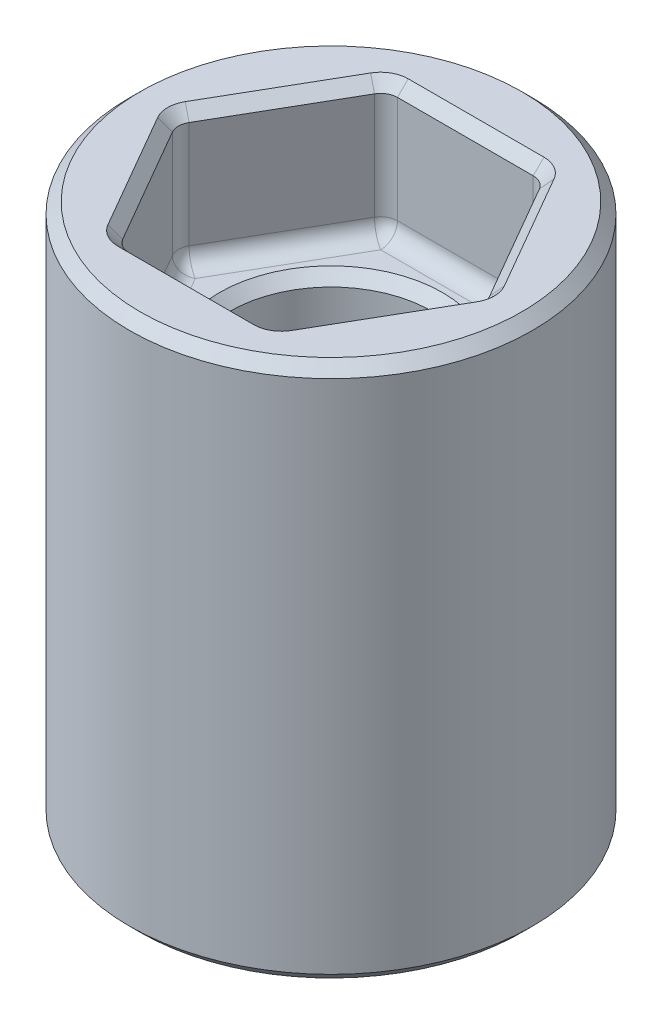
from build123d import *

# Parameters (mm, degrees)
SKETCH4_R           = 4.7625
SKETCH4_R_2         = 1.5875
BOSS_EXTRUDE1_DEPTH = 12.7
CUT_EXTRUDE3_DEPTH  = 3.175
CUT_EXTRUDE2_DEPTH  = 3.175
SKETCH8_R           = 2.38125
CUT_EXTRUDE4_DEPTH  = 3.175
FILLET1_R           = 0.396875
CHAMFER1_SIZE       = 0.254


with BuildPart() as part:
    # Sketch4 → Boss-Extrude1 (new body)
    with BuildSketch(Plane(origin=(0, 0, 0), x_dir=(1, 0, 0), z_dir=(0, 1, 0))):
        with Locations(Location((0, 0, 0), (0, 0, 270))):
            Circle(SKETCH4_R)
        with Locations(Location((0, 0, 0), (0, 0, 270))):
            Circle(SKETCH4_R_2, mode=Mode.SUBTRACT)
    extrude(amount=BOSS_EXTRUDE1_DEPTH)

    # Sketch7 → Cut-Extrude3 (cut)
    with BuildSketch(Plane.XZ):
        Polygon((1.624115175, 2.81305), (-1.624115175, 2.81305), (-3.248230349, 0), (-1.624115175, -2.81305), (1.624115175, -2.81305), (3.248230349, 0), align=None)
    extrude(amount=-CUT_EXTRUDE3_DEPTH, mode=Mode.SUBTRACT)

    # Sketch6 → Cut-Extrude2 (cut)
    with BuildSketch(Plane(origin=(0, 12.7, 0), x_dir=(1, 0, 0), z_dir=(0, 1, 0))):
        Polygon((1.833087105, 3.175), (-1.833087105, 3.175), (-3.666174209, 0), (-1.833087105, -3.175), (1.833087105, -3.175), (3.666174209, 0), align=None)
    extrude(amount=-CUT_EXTRUDE2_DEPTH, mode=Mode.SUBTRACT)

    # Sketch8 → Cut-Extrude4 (cut)
    with BuildSketch(Plane(origin=(0, 9.525, 0), x_dir=(1, 0, 0), z_dir=(0, 1, 0))):
        with Locations(Location((0, 0, 0), (0, 0, 270))):
            Circle(SKETCH8_R)
    extrude(amount=-CUT_EXTRUDE4_DEPTH, mode=Mode.SUBTRACT)

    # Fillet1
    fillet1_edges = [part.edges().sort_by_distance(p)[0] for p in [
        (2.436172762, 3.175, 1.406525),
        (1.624115175, 1.5875, 2.81305),
        (2.436172762, 3.175, -1.406525),
        (3.248230349, 1.5875, 0),
        (0, 3.175, -2.81305),
        (1.624115175, 1.5875, -2.81305),
        (-2.436172762, 3.175, -1.406525),
        (-1.624115175, 1.5875, -2.81305),
        (-2.436172762, 3.175, 1.406525),
        (-3.248230349, 1.5875, 0),
        (0, 3.175, 2.81305),
        (-1.624115175, 1.5875, 2.81305),
        (2.749630657, 9.525, -1.5875),
        (1.833087105, 11.1125, -3.175),
        (2.749630657, 9.525, 1.5875),
        (3.666174209, 11.1125, 0),
        (0, 9.525, 3.175),
        (1.833087105, 11.1125, 3.175),
        (-2.749630657, 9.525, 1.5875),
        (-1.833087105, 11.1125, 3.175),
        (-2.749630657, 9.525, -1.5875),
        (-3.666174209, 11.1125, 0),
        (0, 9.525, -3.175),
        (-1.833087105, 11.1125, -3.175),
        (0, 6.35, -2.38125),
    ]]
    fillet(fillet1_edges, radius=FILLET1_R)

    # Chamfer1
    chamfer1_edges = [part.edges().sort_by_distance(p)[0] for p in [
        (0, 3.175, -1.5875),
        (0, 0, -4.7625),
        (0, 12.7, -4.7625),
        (0, 6.35, -1.5875),
        (0, 9.525, -2.38125),
        (2.436172762, 0, 1.406525),
        (2.436172762, 0, -1.406525),
        (0, 0, -2.81305),
        (-2.436172762, 0, -1.406525),
        (-2.436172762, 0, 1.406525),
        (0, 0, 2.81305),
        (0, 12.7, -3.175),
        (2.749630657, 12.7, -1.5875),
        (-2.749630657, 12.7, 1.5875),
        (-2.749630657, 12.7, -1.5875),
        (0, 12.7, 3.175),
        (2.749630657, 12.7, 1.5875),
        (3.186833573, 0, 0),
        (-1.593416787, 0, -2.759878832),
        (-3.186833573, 0, 0),
        (-1.593416787, 0, 2.759878832),
        (1.593416787, 0, 2.759878832),
        (1.593416787, 0, -2.759878832),
        (1.802388717, 12.7, -3.121828832),
        (-3.604777433, 12.7, 0),
        (-1.802388717, 12.7, 3.121828832),
        (1.802388717, 12.7, 3.121828832),
        (3.604777433, 12.7, 0),
        (-1.802388717, 12.7, -3.121828832),
    ]]
    chamfer(chamfer1_edges, length=CHAMFER1_SIZE)


solid = part.part
